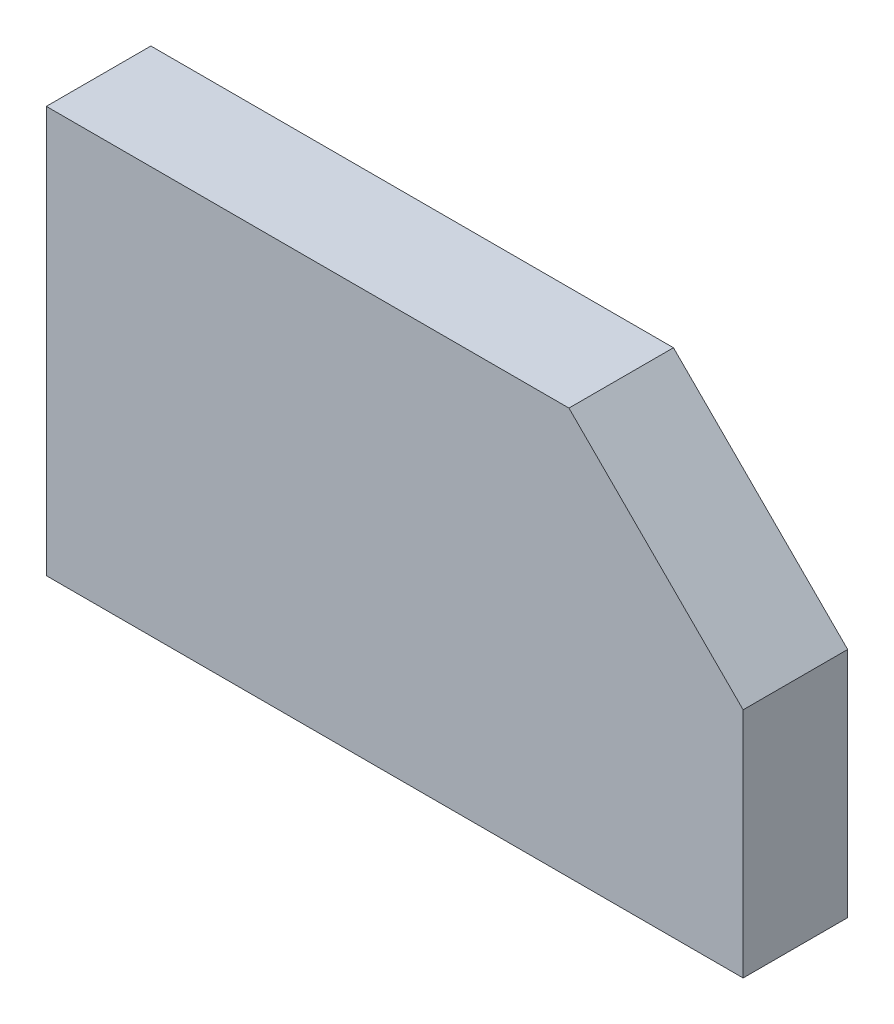
from build123d import *

# Parameters (mm, degrees)
BOSS_EXTRUDE1_DEPTH          = 18
F_4_0_4_DIAMETER_HOLE1_D     = 4
F_4_0_4_DIAMETER_HOLE1_DEPTH = 30
F_4_0_4_DIAMETER_HOLE1_TIP   = 1.201721238
F_4_0_4_DIAMETER_HOLE2_D     = 4
F_4_0_4_DIAMETER_HOLE2_DEPTH = 30
F_4_0_4_DIAMETER_HOLE2_TIP   = 1.201721238


with BuildPart() as part:
    # Sketch1 → Boss-Extrude1 (new body)
    with BuildSketch(Plane.XY):
        Polygon((30, 35), (60, 5), (60, -35), (-60, -35), (-60, 35), align=None)
    extrude(amount=BOSS_EXTRUDE1_DEPTH)

    # Ø4.0 (4) Diameter Hole1
    with Locations(Plane.ZY.offset(60)):
        with Locations((9, 16), (9, -16)):
            Hole(F_4_0_4_DIAMETER_HOLE1_D / 2, depth=F_4_0_4_DIAMETER_HOLE1_DEPTH)
            with Locations((0, 0, -(F_4_0_4_DIAMETER_HOLE1_DEPTH + F_4_0_4_DIAMETER_HOLE1_TIP / 2))):  # 118° drill point
                Cone(0, F_4_0_4_DIAMETER_HOLE1_D / 2, F_4_0_4_DIAMETER_HOLE1_TIP, mode=Mode.SUBTRACT)

    # Ø4.0 (4) Diameter Hole2
    with Locations(Plane(origin=(0, -35, 0), x_dir=(-1, 0, 0), z_dir=(0, -1, 0))):
        with Locations((-35, -9), (20, -9)):
            Hole(F_4_0_4_DIAMETER_HOLE2_D / 2, depth=F_4_0_4_DIAMETER_HOLE2_DEPTH)
            with Locations((0, 0, -(F_4_0_4_DIAMETER_HOLE2_DEPTH + F_4_0_4_DIAMETER_HOLE2_TIP / 2))):  # 118° drill point
                Cone(0, F_4_0_4_DIAMETER_HOLE2_D / 2, F_4_0_4_DIAMETER_HOLE2_TIP, mode=Mode.SUBTRACT)


solid = part.part
